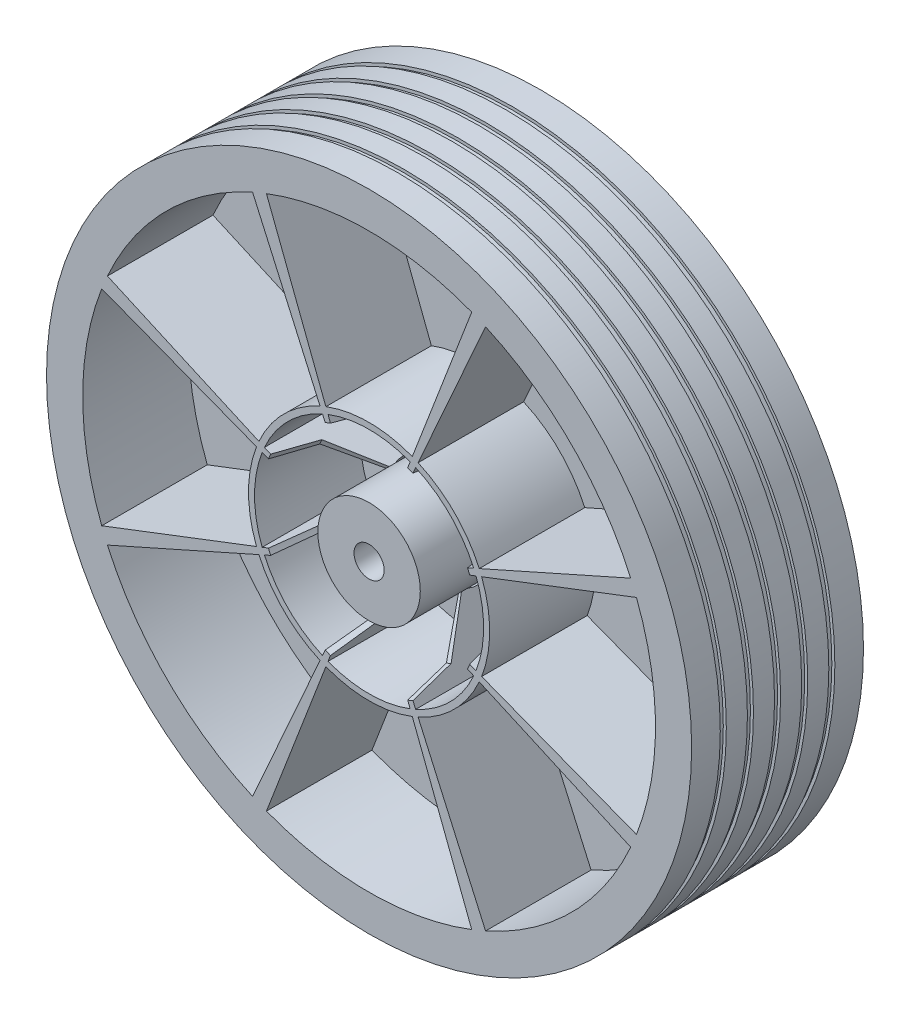
from build123d import *

# Parameters (mm, degrees)
SKETCH1_R           = 107
BOSS_EXTRUDE1_DEPTH = 57
SKETCH3_W           = 2
SKETCH3_H           = 2.636408112
SKETCH7_R           = 25
BOSS_EXTRUDE2_DEPTH = 20
CUT_EXTRUDE1_START  = -35
CUT_EXTRUDE1_DEPTH  = 35
CIRPATTERN5_COUNT   = 8
SKETCH11_R          = 5
CUT_EXTRUDE2_DEPTH  = 170.785158362


with BuildPart() as part:
    # Sketch1 → Boss-Extrude1 (new body)
    with BuildSketch(Plane.XY):
        with Locations(Location((0, 0, 0), (0, 0, 180))):
            Circle(SKETCH1_R)
    extrude(amount=BOSS_EXTRUDE1_DEPTH)

    # Sketch3 → Cut-Revolve3 (revolve, cut)
    with BuildSketch(Plane(origin=(0, 0, 0), x_dir=(0, 0, -1), z_dir=(1, 0, 0)), mode=Mode.PRIVATE) as cut_revolve3_sk:
        with Locations((-46.5, 107.318204056)):
            Rectangle(SKETCH3_W, SKETCH3_H)
        with Locations((-37.5, 107.318204056)):
            Rectangle(SKETCH3_W, SKETCH3_H)
        with Locations((-28.5, 107.318204056)):
            Rectangle(SKETCH3_W, SKETCH3_H)
        with Locations((-19.5, 107.318204056)):
            Rectangle(SKETCH3_W, SKETCH3_H)
        with Locations((-10.5, 107.318204056)):
            Rectangle(SKETCH3_W, SKETCH3_H)
    revolve(cut_revolve3_sk.sketch.rotate(Axis((0, 0, 0), (0, 0, 1)), 90), axis=Axis((0, 0, 0), (0, 0, 1)), mode=Mode.SUBTRACT)

    # Sketch6 → Cut-Revolve4 (revolve, cut)
    with BuildSketch(Plane(origin=(0, 0, 0), x_dir=(0, 0, -1), z_dir=(1, 0, 0)), mode=Mode.PRIVATE) as cut_revolve4_sk:
        Polygon((5, 95), (5, 25), (-5, 25), (-10, 95), align=None)
    revolve(cut_revolve4_sk.sketch.rotate(Axis((0, 0, -20.482166518), (0, 0, 1)), 270), axis=Axis((0, 0, -20.482166518), (0, 0, 1)), mode=Mode.SUBTRACT)

    # Sketch7 → Boss-Extrude2 (add)
    with BuildSketch(Plane(origin=(0, 0, 0), x_dir=(-1, 0, 0), z_dir=(0, 0, -1))):
        Circle(SKETCH7_R)
    extrude(amount=BOSS_EXTRUDE2_DEPTH)

    # Sketch8 → Cut-Extrude1 (cut)
    with BuildSketch(Plane.XY.offset(57).offset(CUT_EXTRUDE1_START)):
        with BuildLine():
            Line((14.334717982, 37.34321706), (34.044955207, 88.690140517))
            ThreePointArc((34.044955207, 88.690140517), (0, 95), (-34.044955207, 88.690140517))
            Line((-34.044955207, 88.690140517), (-14.334717982, 37.34321706))
            ThreePointArc((-14.334717982, 37.34321706), (0, 40), (14.334717982, 37.34321706))
        make_face()
        with BuildLine():
            Line((-13.617982083, 35.476056207), (-6.271439117, 16.337657464))
            ThreePointArc((-6.271439117, 16.337657464), (0, 17.5), (6.271439117, 16.337657464))
            Line((6.271439117, 16.337657464), (13.617982083, 35.476056207))
            ThreePointArc((13.617982083, 35.476056207), (0, 38), (-13.617982083, 35.476056207))
        make_face()
    cut_extrude1 = extrude(amount=CUT_EXTRUDE1_DEPTH, mode=Mode.SUBTRACT)

    # CirPattern5: Cut-Extrude1 ×8 about axis
    cirpattern5_axis = Axis((0, 0, 0), (0, 0, 1))
    for i in range(1, CIRPATTERN5_COUNT):
        add(cut_extrude1.rotate(cirpattern5_axis, i * 360 / CIRPATTERN5_COUNT), mode=Mode.SUBTRACT)

    # Sketch10 → Cut-Revolve5 (revolve, cut)
    with BuildSketch(Plane(origin=(0, 0, 0), x_dir=(0, 0, -1), z_dir=(1, 0, 0)), mode=Mode.PRIVATE) as cut_revolve5_sk:
        Polygon((-58, 35.987045509), (-43, 32.476056207), (-33, 16.987045509), (-58, 16.987045509), align=None)
    revolve(cut_revolve5_sk.sketch.rotate(Axis((0, 0, 0), (0, 0, 1)), 90), axis=Axis((0, 0, 0), (0, 0, 1)), mode=Mode.SUBTRACT)

    # Sketch11 → Cut-Extrude2 (cut, through all)
    with BuildSketch(Plane.XY.offset(57)):
        Circle(SKETCH11_R)
    extrude(amount=-CUT_EXTRUDE2_DEPTH, mode=Mode.SUBTRACT)


solid = part.part
